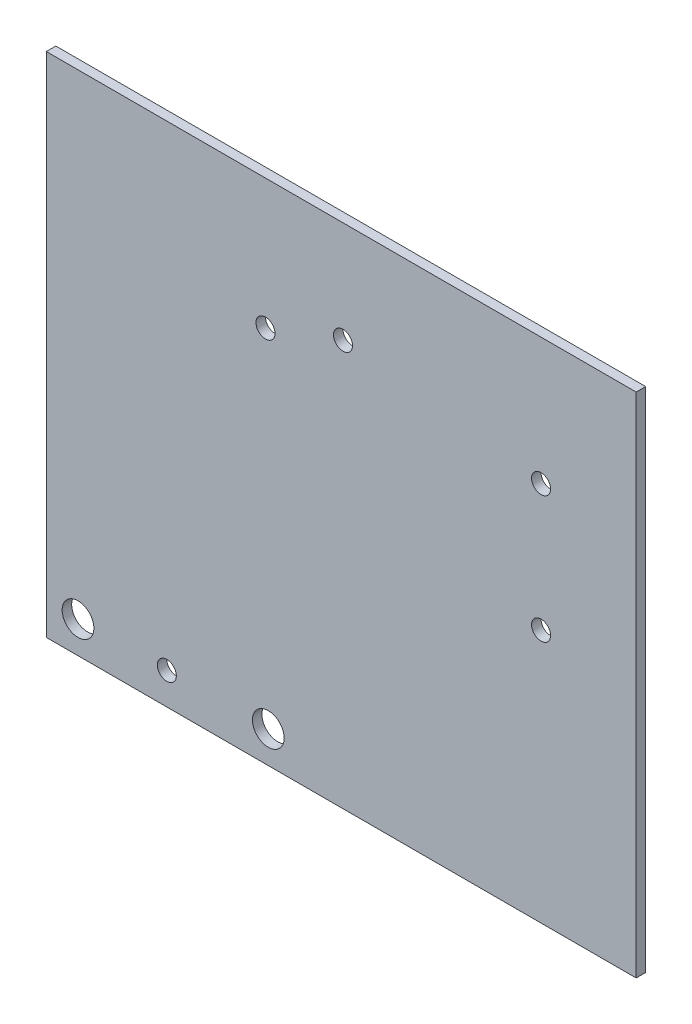
from build123d import *

# Parameters (mm, degrees)
SKETCH1_W                       = 93
SKETCH1_H                       = 80
BOSS_EXTRUDE1_DEPTH             = 1.5
F_5_0MM_PRESS_DOWEL_HOLE1_D     = 5
F_5_0MM_PRESS_DOWEL_HOLE1_DEPTH = 6
F_5_0MM_PRESS_DOWEL_HOLE1_TIP   = 1.502151548
F_3_0MM_DOWEL_HOLE1_D           = 3
F_3_0MM_DOWEL_HOLE2_D           = 3
F_3_0MM_DOWEL_HOLE2_DEPTH       = 2.999
F_3_0MM_DOWEL_HOLE2_TIP         = 0.901290929
F_3_0MM_DOWEL_HOLE3_D           = 3


with BuildPart() as part:
    # Sketch1 → Boss-Extrude1 (new body)
    with BuildSketch(Plane.XY):
        with Locations((46.5, 40)):
            Rectangle(SKETCH1_W, SKETCH1_H)
    extrude(amount=BOSS_EXTRUDE1_DEPTH)

    # Ø5.0mm Press Dowel Hole1
    with Locations(Plane(origin=(19.881275608, -7.745569698, 0), x_dir=(-1, 0, 0), z_dir=(0, 0, -1))):
        with Locations((-15.118724392, 12.745569698), (14.881275608, 12.745569698)):
            Hole(F_5_0MM_PRESS_DOWEL_HOLE1_D / 2, depth=F_5_0MM_PRESS_DOWEL_HOLE1_DEPTH)
            with Locations((0, 0, -(F_5_0MM_PRESS_DOWEL_HOLE1_DEPTH + F_5_0MM_PRESS_DOWEL_HOLE1_TIP / 2))):  # 118° drill point
                Cone(0, F_5_0MM_PRESS_DOWEL_HOLE1_D / 2, F_5_0MM_PRESS_DOWEL_HOLE1_TIP, mode=Mode.SUBTRACT)

    # Ø3.0mm Dowel Hole1 (through all)
    with Locations(Plane(origin=(19.881275608, -7.745569698, -1.5), x_dir=(-1, 0, 0), z_dir=(0, 0, -1))):
        with Locations((-26.893032931, 71.71065686), (-14.67702886, 67.264394997)):
            Hole(F_3_0MM_DOWEL_HOLE1_D / 2)

    # Ø3.0mm Dowel Hole2
    with Locations(Plane(origin=(19.881275608, -7.745569698, 0), x_dir=(-1, 0, 0), z_dir=(0, 0, -1))):
        with Locations((-58.118724392, 67.745569698), (-58.118724392, 47.745569698)):
            Hole(F_3_0MM_DOWEL_HOLE2_D / 2, depth=F_3_0MM_DOWEL_HOLE2_DEPTH)
            with Locations((0, 0, -(F_3_0MM_DOWEL_HOLE2_DEPTH + F_3_0MM_DOWEL_HOLE2_TIP / 2))):  # 118° drill point
                Cone(0, F_3_0MM_DOWEL_HOLE2_D / 2, F_3_0MM_DOWEL_HOLE2_TIP, mode=Mode.SUBTRACT)

    # Ø3.0mm Dowel Hole3 (through all)
    with Locations(Plane(origin=(19.881275608, -7.745569698, 3), x_dir=(1, 0, 0), z_dir=(0, 0, 1))):
        with Locations((-0.881275608, 12.745569698)):
            Hole(F_3_0MM_DOWEL_HOLE3_D / 2)


solid = part.part
